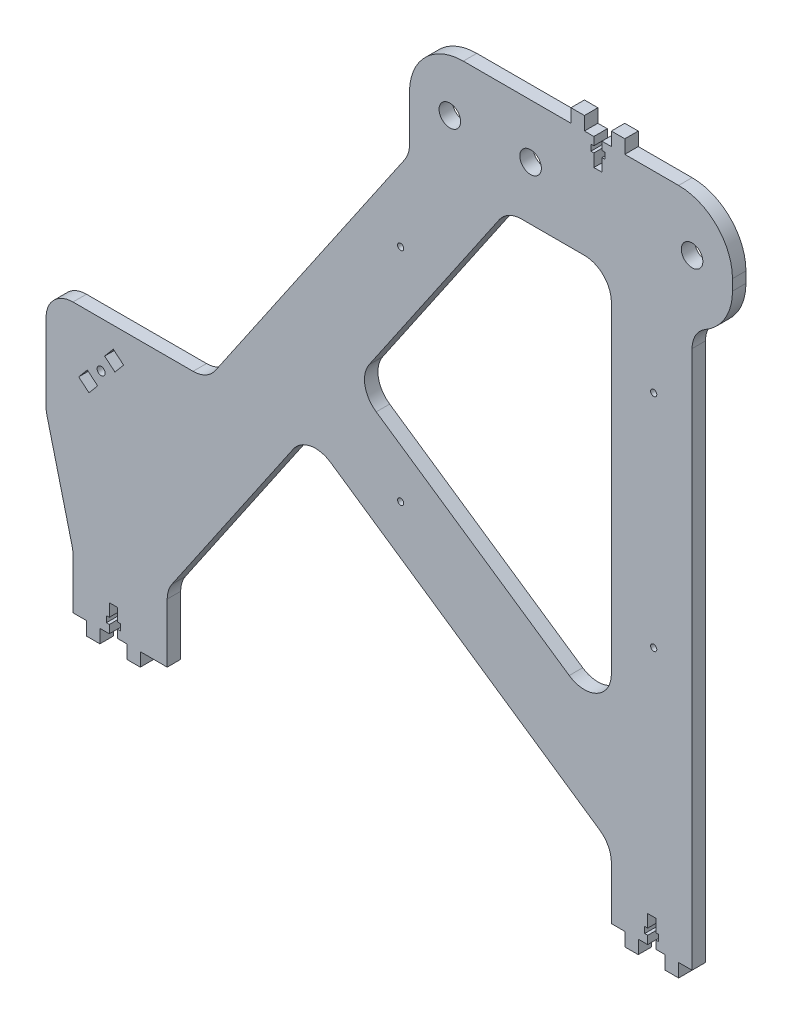
from build123d import *

# Parameters (mm, degrees)
ESQUISSE1_R        = 4
ESQUISSE1_R_2      = 1.15
ESQUISSE1_R_3      = 1.5
BOSS_EXTRU_1_DEPTH = 5
CONG_1_R           = 10
CONG_2_R           = 20


with BuildPart() as part:
    # Esquisse1 → Boss.-Extru.1 (new body)
    with BuildSketch(Plane.XY):
        Polygon((-21.5, 0), (-25, 0), (-25, -5), (-30, -5), (-30, 0), (-35, 0), (-35, 20), (-45, 60), (-45, 100), (14.886620542, 100), (90, 210), (90, 250), (117.313956166, 250), (150, 250), (150, 255), (155, 255), (155, 250), (158.5, 250), (158.5, 247), (157.4, 247), (157.4, 244.7), (158.5, 244.7), (158.5, 240), (161.5, 240), (161.5, 244.7), (162.6, 244.7), (162.6, 247), (161.5, 247), (161.5, 250), (165, 250), (165, 255), (170, 255), (170, 250), (210, 250), (210, 210), (195, 210), (195, 0), (190, 0), (190, -5), (185, -5), (185, 0), (181.5, 0), (181.5, 3), (182.6, 3), (182.6, 5.3), (181.5, 5.3), (181.5, 10), (178.5, 10), (178.5, 5.3), (177.4, 5.3), (177.4, 3), (178.5, 3), (178.5, 0), (175, 0), (175, -5), (170, -5), (170, 0), (165, 0), (165, 25), (52.470534613, 101.840622125), (0, 25), (0, 0), (-10, 0), (-10, -5), (-15, -5), (-15, 0), (-18.5, 0), (-18.5, 3), (-17.4, 3), (-17.4, 5.3), (-18.5, 5.3), (-18.5, 10), (-21.5, 10), (-21.5, 5.3), (-22.6, 5.3), (-22.6, 3), (-21.5, 3), align=None)
        with Locations((135, 230)):
            Circle(ESQUISSE1_R, mode=Mode.SUBTRACT)
        with Locations((195, 230)):
            Circle(ESQUISSE1_R, mode=Mode.SUBTRACT)
        with Locations((105, 230)):
            Circle(ESQUISSE1_R, mode=Mode.SUBTRACT)
        with Locations((86.729297438, 178.610587107)):
            Circle(ESQUISSE1_R_2, mode=Mode.SUBTRACT)
        with Locations((180.729297438, 96.610587107)):
            Circle(ESQUISSE1_R_2, mode=Mode.SUBTRACT)
        with Locations((86.729297438, 96.610587107)):
            Circle(ESQUISSE1_R_2, mode=Mode.SUBTRACT)
        with Locations((180.729297438, 178.610587107)):
            Circle(ESQUISSE1_R_2, mode=Mode.SUBTRACT)
        with Locations((-24.543125869, 83.023041686)):
            Circle(ESQUISSE1_R_3, mode=Mode.SUBTRACT)
        Polygon((165, 210), (126.32704727, 210), (69.388067414, 126.61555066), (165, 61.32704727), align=None, mode=Mode.SUBTRACT)
        Polygon((-29.672175025, 80.799788495), (-32.886113073, 76.969566279), (-29.055890858, 73.755628231), (-25.841952809, 77.585850447), align=None, mode=Mode.SUBTRACT)
        Polygon((-23.244298928, 88.460232926), (-20.03036088, 92.290455142), (-16.200138664, 89.076517093), (-19.414076712, 85.246294878), align=None, mode=Mode.SUBTRACT)
    extrude(amount=BOSS_EXTRU_1_DEPTH)

    # Congé1
    cong_1_edges = [part.edges().sort_by_distance(p)[0] for p in [
        (-35, 20, 2.5),
        (-45, 60, 2.5),
        (-45, 100, 2.5),
        (14.886620542, 100, 2.5),
        (90, 210, 2.5),
        (195, 210, 2.5),
        (165, 25, 2.5),
        (52.470534613, 101.840622125, 2.5),
        (0, 25, 2.5),
        (126.32704727, 210, 2.5),
        (69.388067414, 126.61555066, 2.5),
        (165, 61.32704727, 2.5),
        (165, 210, 2.5),
    ]]
    fillet(cong_1_edges, radius=CONG_1_R)

    # Congé2
    cong_2_edges = [part.edges().sort_by_distance(p)[0] for p in [
        (90, 250, 2.5),
        (210, 250, 2.5),
        (210, 210, 2.5),
    ]]
    fillet(cong_2_edges, radius=CONG_2_R)


solid = part.part
